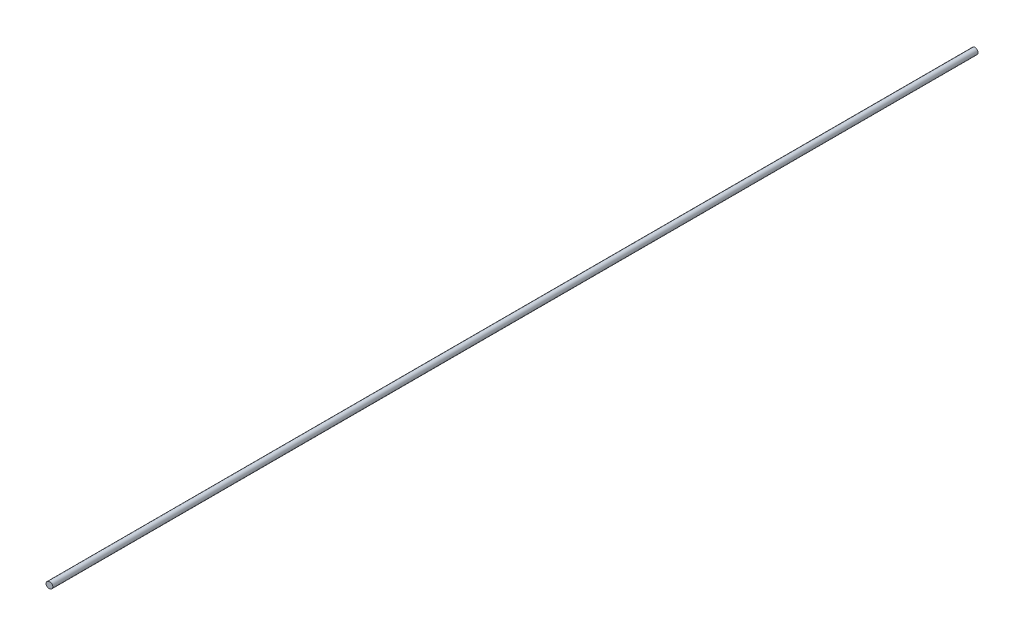
from build123d import *

# Parameters (mm, degrees)
SKETCH1_R               = 1.5
BOSS_EXTRUDE1_DEPTH     = 450
CUT_EXTRUDE1_DEPTH      = 451.004999972
CUT_EXTRUDE1_DEPTH_BACK = 451.004999972


with BuildPart() as part:
    # Sketch1 → Boss-Extrude1 (new body)
    with BuildSketch(Plane.XY):
        Circle(SKETCH1_R)
    extrude(amount=BOSS_EXTRUDE1_DEPTH)

    # Sketch3 → Cut-Extrude1 (cut, two sides: drawn at the far end of the back side and taken through both)
    with BuildSketch(Plane(origin=(0, 0, 0), x_dir=(1, 0, 0), z_dir=(0, 1, 0)).offset(-CUT_EXTRUDE1_DEPTH_BACK)):
        Polygon((-1.5, -450), (1.5, -450), (1.5, -449.676214659), align=None)
    extrude(amount=CUT_EXTRUDE1_DEPTH + CUT_EXTRUDE1_DEPTH_BACK, mode=Mode.SUBTRACT)


solid = part.part
